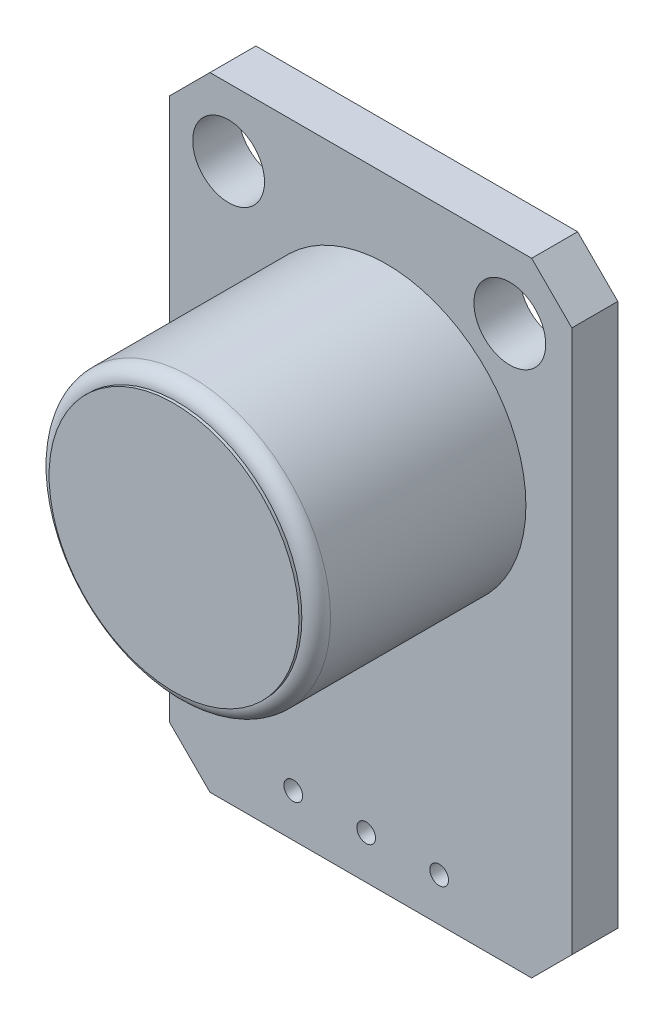
from build123d import *

# Parameters (mm, degrees)
SKETCH1_R           = 1.25
SKETCH1_R_2         = 4.85
SKETCH1_R_3         = 0.325511789
BOSS_EXTRUDE1_DEPTH = 1.6
BOSS_EXTRUDE2_START = 1.6
SKETCH1_3_R         = 4.85
BOSS_EXTRUDE2_DEPTH = 7.3
FILLET1_R           = 0.5
SKETCH2_R           = 4.35
BOSS_EXTRUDE3_DEPTH = 0.1


with BuildPart() as part:
    # Sketch1 → Boss-Extrude1 (new body)
    # profile 1 of 2: a face of its own
    with BuildSketch(Plane.XY):
        Polygon((0, 20.3), (1.4, 21.7), (12.6, 21.7), (14, 20.3), (14, 1.4), (12.6, 0), (1.4, 0), (0, 1.4), align=None)
        with Locations((2.05, 19.35)):
            Circle(SKETCH1_R, mode=Mode.SUBTRACT)
        with Locations((11.84, 19.35)):
            Circle(SKETCH1_R, mode=Mode.SUBTRACT)
        with Locations((7.55, 14.15)):
            Circle(SKETCH1_R_2, mode=Mode.SUBTRACT)
        with Locations((9.38, 1.5)):
            Circle(SKETCH1_R_3, mode=Mode.SUBTRACT)
        with Locations((6.84, 1.5)):
            Circle(SKETCH1_R_3, mode=Mode.SUBTRACT)
        with Locations((4.3, 1.5)):
            Circle(SKETCH1_R_3, mode=Mode.SUBTRACT)
    # profile 2 of 2: a face of its own
    with BuildSketch(Plane.XY):
        with Locations((7.55, 14.15)):
            Circle(SKETCH1_R_2)
    extrude(amount=BOSS_EXTRUDE1_DEPTH)

    # Sketch1<3> → Boss-Extrude2 (add)
    with BuildSketch(Plane.XY.offset(BOSS_EXTRUDE2_START)):
        with Locations((7.55, 14.15)):
            Circle(SKETCH1_3_R)
    extrude(amount=BOSS_EXTRUDE2_DEPTH)

    # Fillet1
    fillet1_edges = [part.edges().sort_by_distance(p)[0] for p in [
        (2.7, 14.15, 8.9),
    ]]
    fillet(fillet1_edges, radius=FILLET1_R)

    # Sketch2 → Boss-Extrude3 (add)
    with BuildSketch(Plane.XY.offset(8.9)):
        with Locations((7.55, 14.15)):
            Circle(SKETCH2_R)
    extrude(amount=BOSS_EXTRUDE3_DEPTH)


solid = part.part
